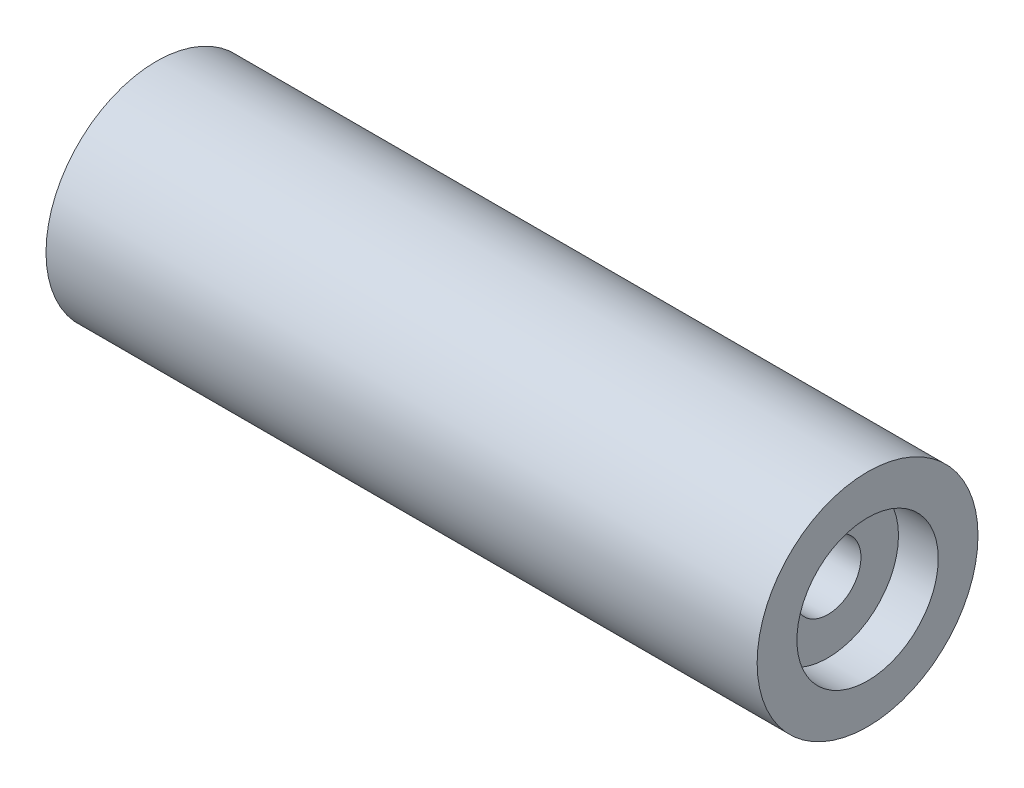
from build123d import *

# Parameters (mm, degrees)
IZIM1_R                     = 25
IZIM1_R_2                   = 7.5
Y_KSEKLIK_EKSTR_ZYON1_DEPTH = 80.5
IZIM2_R                     = 16
KES_EKSTR_ZYON1_DEPTH       = 9


with BuildPart() as part:
    # Çizim1 → Yükseklik-Ekstrüzyon1 (new, symmetric)
    with BuildSketch(Plane(origin=(0, 0, 0), x_dir=(0, 0, -1), z_dir=(1, 0, 0))):
        Circle(IZIM1_R)
        Circle(IZIM1_R_2, mode=Mode.SUBTRACT)
    extrude(amount=Y_KSEKLIK_EKSTR_ZYON1_DEPTH, both=True)

    # Çizim2 → Kes-Ekstrüzyon1 (cut)
    with BuildSketch(Plane(origin=(80.5, 0, 0), x_dir=(0, 0, -1), z_dir=(1, 0, 0))):
        Circle(IZIM2_R)
    kes_ekstr_zyon1 = extrude(amount=-KES_EKSTR_ZYON1_DEPTH, mode=Mode.SUBTRACT)

    # Aynalama1: Kes-Ekstrüzyon1 across plane
    add(kes_ekstr_zyon1.mirror(Plane(origin=(0, 0, 0), x_dir=(0, 0, 1), z_dir=(1, 0, 0))), mode=Mode.SUBTRACT)


solid = part.part
